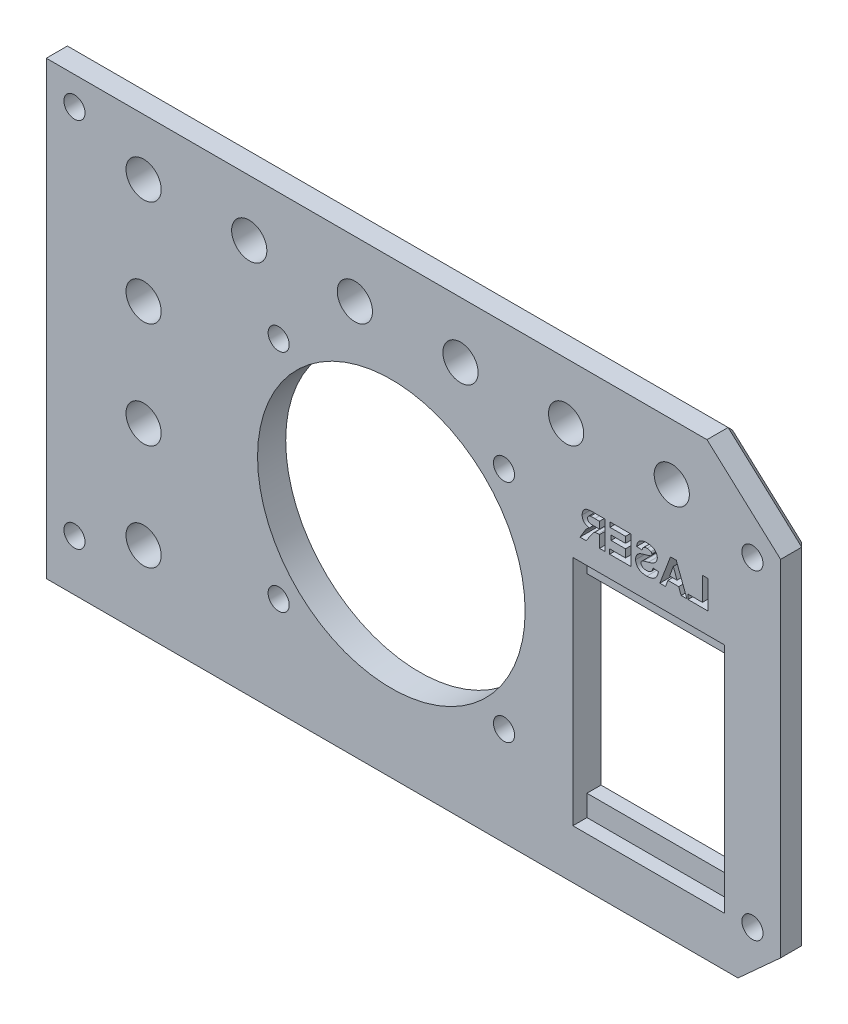
from build123d import *

# Parameters (mm, degrees)
EXTRUDE_1_DEPTH     = 4
SKETCH_3_W          = 21.5
SKETCH_3_H          = 27
CUT_EXTRUDE_1_DEPTH = 62.305061766
CUT_EXTRUDE_2_DEPTH = 10
CUT_EXTRUDE_3_DEPTH = 10
SKETCH_5_R          = 1.5
CUT_EXTRUDE_4_DEPTH = 10
CUT_EXTRUDE_5_DEPTH = 2
SKETCH_7_R          = 1.5
CUT_EXTRUDE_6_DEPTH = 4
SKETCH_8_R          = 2.5
CUT_EXTRUDE_7_DEPTH = 5
SKETCH_9_R          = 2.5
CUT_EXTRUDE_8_DEPTH = 5
CHAMFER_1_SIZE      = 1


with BuildPart() as part:
    # Эскиз1 → Бобышка-Вытянуть1 (new body)
    with BuildSketch(Plane.XY):
        Polygon((41.682625066, 32), (52.137420325, 22.505793147), (52.137420325, -26.505793147), (46.087330134, -32), (-52.137420325, -32), (-52.137420325, 32), align=None)
    extrude(amount=EXTRUDE_1_DEPTH)

    # Эскиз3 → Вырез-Вытянуть1 (cut, through all)
    with BuildSketch(Plane(origin=(0, 0, 0), x_dir=(-1, 0, 0), z_dir=(0, 0, -1))):
        with Locations((-33.387420325, -8.5)):
            Rectangle(SKETCH_3_W, SKETCH_3_H)
    extrude(amount=-CUT_EXTRUDE_1_DEPTH, mode=Mode.SUBTRACT)

    # Эскиз2 → Вырез-Вытянуть2 (cut)
    with BuildSketch(Plane(origin=(0, 0, 0), x_dir=(-1, 0, 0), z_dir=(0, 0, -1))):
        with BuildLine():
            ThreePointArc((3.137420325, 17), (-10.297608518, -15.435028843), (22.137420325, -2))
            ThreePointArc((22.137420325, -2), (16.572449168, 11.435028843), (3.137420325, 17))
        make_face()
    extrude(amount=-CUT_EXTRUDE_2_DEPTH, mode=Mode.SUBTRACT)

    # Эскиз4 → Вырез-Вытянуть3 (cut)
    # profile 1 of 5: a face of its own
    with BuildSketch(Plane(origin=(0, 0, 0), x_dir=(-1, 0, 0), z_dir=(0, 0, -1))):
        Polygon((-41.804576949, 11), (-41.804576949, 15), (-41.03534618, 15), (-41.03534618, 11.666666667), (-38.984064128, 11.666666667), (-38.984064128, 11), align=None)
    # profile 2 of 5: a face of its own
    with BuildSketch(Plane(origin=(0, 0, 0), x_dir=(-1, 0, 0), z_dir=(0, 0, -1))):
        Polygon((-34.984064128, 11), (-35.799769257, 11), (-36.137109, 11.923076923), (-37.67236541, 11.923076923), (-38.009705154, 11), (-38.830217975, 11), (-37.318198744, 15), (-36.503294898, 15), align=None)
        Polygon((-36.381500026, 12.58974359), (-36.907141051, 14.025641026), (-37.431179513, 12.58974359), align=None, mode=Mode.SUBTRACT)
    # profile 3 of 5: a face of its own
    with BuildSketch(Plane(origin=(0, 0, 0), x_dir=(-1, 0, 0), z_dir=(0, 0, -1))):
        with BuildLine():
            Line((-34.778935923, 12.333333333), (-34.009705154, 12.384615385))
            add(Edge.make_bspline(
                [(-34.009705154, 12.384615385), (-34.00357691, 12.352433478), (-33.991673186, 12.289922172), (-33.965225348, 12.200835025), (-33.936113597, 12.117780539), (-33.901323459, 12.041649332), (-33.863237144, 11.971034163), (-33.818725848, 11.907946687), (-33.770894791, 11.850372682), (-33.717376243, 11.80037996), (-33.65906848, 11.756595643), (-33.595680552, 11.719254919), (-33.527899321, 11.686935848), (-33.455559054, 11.660322118), (-33.377914175, 11.640454838), (-33.295641083, 11.626320447), (-33.208621785, 11.617269173), (-33.149151024, 11.616023084), (-33.118679513, 11.615384615)],
                knots=[0, 0, 0, 0, 1.204560339, 2.339781841, 3.415289417, 4.440034832, 5.416475564, 6.362424008, 7.275913008, 8.16578645, 9.05021719, 9.95355393, 10.867835453, 11.809845306, 12.784702352, 13.812224031, 14.87903166, 16, 16, 16, 16], degree=3))
            add(Edge.make_bspline(
                [(-33.118679513, 11.615384615), (-33.08660632, 11.615734532), (-33.024222307, 11.616415138), (-32.933820976, 11.624858649), (-32.849291624, 11.636954887), (-32.771380677, 11.656102948), (-32.698633221, 11.677517025), (-32.632856002, 11.706813764), (-32.572984586, 11.740603317), (-32.519173216, 11.778945704), (-32.472211984, 11.821470163), (-32.431127954, 11.865864318), (-32.395346478, 11.911169054), (-32.367183924, 11.959394794), (-32.344392347, 12.008591091), (-32.32932871, 12.060225556), (-32.319152332, 12.113112549), (-32.317985398, 12.149257204), (-32.317397462, 12.167467949)],
                knots=[0, 0, 0, 0, 1.417779877, 2.757654889, 4.012140507, 5.189587551, 6.302846416, 7.360586765, 8.365575446, 9.33904572, 10.275781718, 11.161696098, 12.012180333, 12.822428111, 13.625933072, 14.403138519, 15.195454004, 16, 16, 16, 16], degree=3))
            add(Edge.make_bspline(
                [(-32.317397462, 12.167467949), (-32.318118515, 12.190284535), (-32.31952915, 12.234921847), (-32.336511788, 12.298735775), (-32.361979986, 12.357857535), (-32.400326293, 12.411413899), (-32.451873168, 12.46035661), (-32.517626343, 12.506141318), (-32.599421217, 12.547329649), (-32.660102373, 12.570304576), (-32.692397462, 12.582532051)],
                knots=[0, 0, 0, 0, 0.90494901, 1.770400303, 2.607161909, 3.452839393, 4.36912122, 5.420987164, 6.627424851, 8, 8, 8, 8], degree=3))
            add(Edge.make_bspline(
                [(-32.692397462, 12.582532051), (-32.706254429, 12.587175585), (-32.737264071, 12.597567059), (-32.790163229, 12.612425887), (-32.853881669, 12.630980616), (-32.929340164, 12.652071027), (-33.016513342, 12.673640966), (-33.114427591, 12.700212683), (-33.224276595, 12.726653713), (-33.30112709, 12.746172475), (-33.341435923, 12.756410256)],
                knots=[0, 0, 0, 0, 0.521821638, 1.167752076, 1.961721917, 2.891982557, 3.96540661, 5.168436773, 6.514817513, 8, 8, 8, 8], degree=3))
            add(Edge.make_bspline(
                [(-33.341435923, 12.756410256), (-33.393929987, 12.769516799), (-33.4952087, 12.79480373), (-33.639655336, 12.839787389), (-33.77269333, 12.884481144), (-33.893041741, 12.932976266), (-34.002028061, 12.981986112), (-34.097889405, 13.034951496), (-34.182626189, 13.089121737), (-34.232004279, 13.129609899), (-34.255698744, 13.149038462)],
                knots=[0, 0, 0, 0, 1.293880989, 2.496331788, 3.617634808, 4.64976062, 5.598842568, 6.473791081, 7.267636666, 8, 8, 8, 8], degree=3))
            add(Edge.make_bspline(
                [(-34.255698744, 13.149038462), (-34.28508296, 13.176550777), (-34.342693432, 13.230491214), (-34.418528678, 13.319125706), (-34.482250934, 13.412753864), (-34.534701327, 13.51068459), (-34.575087137, 13.613481666), (-34.60371208, 13.72045701), (-34.622239184, 13.831889817), (-34.624129747, 13.907778199), (-34.625089769, 13.946314103)],
                knots=[0, 0, 0, 0, 1.064429417, 2.086912298, 3.078678339, 4.055528992, 5.020032834, 5.993708893, 6.981211098, 8, 8, 8, 8], degree=3))
            add(Edge.make_bspline(
                [(-34.625089769, 13.946314103), (-34.623220118, 13.996179102), (-34.619511287, 14.095096377), (-34.585498891, 14.240491268), (-34.532516871, 14.38078614), (-34.471070291, 14.492185464), (-34.412033385, 14.576459473), (-34.363007533, 14.636933731), (-34.309147897, 14.693531823), (-34.249716716, 14.744873142), (-34.186920816, 14.793965044), (-34.118327243, 14.83755924), (-34.045880831, 14.878622561), (-33.94104262, 14.927301218), (-33.798701096, 14.97802916), (-33.613507127, 15.020789596), (-33.411867566, 15.046494141), (-33.272070238, 15.049647545), (-33.199609, 15.051282051)],
                knots=[0, 0, 0, 0, 1.180131776, 2.341029169, 3.518901375, 4.725685298, 5.343762192, 5.955650671, 6.568945152, 7.192346361, 7.815201106, 8.455999361, 9.116257477, 9.787318263, 11.192748436, 12.688084276, 14.283332633, 16, 16, 16, 16], degree=3))
            add(Edge.make_bspline(
                [(-33.199609, 15.051282051), (-33.140277678, 15.050488643), (-33.024879524, 15.04894548), (-32.857596495, 15.033340774), (-32.70134507, 15.009053893), (-32.556673553, 14.97419019), (-32.423514538, 14.928126087), (-32.301351861, 14.873255031), (-32.19028933, 14.808109319), (-32.091679023, 14.732315102), (-32.003826692, 14.648756839), (-31.927189582, 14.557486966), (-31.861474696, 14.459658163), (-31.806257918, 14.355341924), (-31.762896327, 14.244001911), (-31.731048951, 14.125777055), (-31.70998482, 14.000945627), (-31.704705031, 13.915409885), (-31.702012846, 13.871794872)],
                knots=[0, 0, 0, 0, 1.325124071, 2.577337985, 3.749592149, 4.855247722, 5.896868755, 6.892903601, 7.842551483, 8.766257401, 9.665194363, 10.546067736, 11.423174165, 12.293291263, 13.177512979, 14.086532529, 15.024315359, 16, 16, 16, 16], degree=3))
            Line((-31.702012846, 13.871794872), (-32.471243616, 13.820512821))
            add(Edge.make_bspline(
                [(-32.471243616, 13.820512821), (-32.475681114, 13.844633834), (-32.484329336, 13.891643182), (-32.503132939, 13.958970118), (-32.524342491, 14.021239855), (-32.549167173, 14.078451993), (-32.57915239, 14.129581808), (-32.611784922, 14.176237871), (-32.647964954, 14.217798517), (-32.688890419, 14.253125682), (-32.733154944, 14.285271953), (-32.783600902, 14.311037934), (-32.838114552, 14.334943093), (-32.898769808, 14.35291391), (-32.964401869, 14.367169008), (-33.035048965, 14.377736811), (-33.110857537, 14.382896607), (-33.16301104, 14.384029343), (-33.189993616, 14.384615385)],
                knots=[0, 0, 0, 0, 1.151066407, 2.24330871, 3.278475654, 4.238599069, 5.165719782, 6.056502506, 6.909492653, 7.744782051, 8.590364415, 9.471203867, 10.39832458, 11.382154319, 12.435022857, 13.550631277, 14.73277401, 16, 16, 16, 16], degree=3))
            add(Edge.make_bspline(
                [(-33.189993616, 14.384615385), (-33.218048125, 14.384098006), (-33.272629426, 14.383091423), (-33.35216893, 14.376914172), (-33.426782952, 14.365511561), (-33.496837943, 14.35066819), (-33.562240326, 14.33047481), (-33.622852082, 14.305852292), (-33.678950515, 14.276864008), (-33.713156894, 14.254057026), (-33.730057718, 14.242788462)],
                knots=[0, 0, 0, 0, 1.186678824, 2.308736671, 3.37120409, 4.377216403, 5.334874112, 6.262130804, 7.141346615, 8, 8, 8, 8], degree=3))
            add(Edge.make_bspline(
                [(-33.730057718, 14.242788462), (-33.749399293, 14.227395282), (-33.786857919, 14.197583471), (-33.827171328, 14.13838735), (-33.851440093, 14.071527107), (-33.854361115, 14.024245686), (-33.855859, 14)],
                knots=[0, 0, 0, 0, 1.037857257, 2.010007357, 2.979541333, 4, 4, 4, 4], degree=3))
            add(Edge.make_bspline(
                [(-33.855859, 14), (-33.854634003, 13.977340797), (-33.852220953, 13.932705773), (-33.827882237, 13.869300756), (-33.790452609, 13.810551447), (-33.75548076, 13.778638052), (-33.737269257, 13.762019231)],
                knots=[0, 0, 0, 0, 0.98538058, 1.941042925, 2.927803204, 4, 4, 4, 4], degree=3))
            add(Edge.make_bspline(
                [(-33.737269257, 13.762019231), (-33.722816082, 13.751232782), (-33.690519252, 13.727129559), (-33.631357863, 13.696492082), (-33.559948513, 13.663309843), (-33.474663242, 13.630870542), (-33.376068854, 13.598491456), (-33.264159354, 13.564683947), (-33.138865911, 13.530422541), (-33.003382195, 13.497242047), (-32.865828065, 13.464627528), (-32.734563948, 13.428970653), (-32.612507196, 13.394207957), (-32.500223751, 13.357771011), (-32.397134813, 13.322299757), (-32.303741151, 13.285868225), (-32.219401488, 13.250387989), (-32.121052091, 13.201600151), (-32.009582941, 13.135515053), (-31.892750698, 13.039449342), (-31.789427487, 12.931465208), (-31.717434619, 12.829643618), (-31.667979286, 12.742074342), (-31.63613527, 12.672271432), (-31.608587698, 12.598716766), (-31.58616405, 12.52132906), (-31.5699123, 12.439999421), (-31.556463032, 12.355349208), (-31.549591551, 12.266675381), (-31.548646757, 12.206206141), (-31.548166692, 12.175480769)],
                knots=[0, 0, 0, 0, 0.511875881, 1.143829537, 1.88775736, 2.750598373, 3.734912702, 4.837306479, 6.073130119, 7.42648979, 8.801963576, 10.091065733, 11.292408984, 12.408830014, 13.446061236, 14.39066453, 15.257936293, 16.045629259, 17.510392066, 18.929669597, 20.331293837, 21.746891395, 22.460690638, 23.187651344, 23.925159671, 24.69163991, 25.474819891, 26.281170188, 27.126635539, 28, 28, 28, 28], degree=3))
            add(Edge.make_bspline(
                [(-31.548166692, 12.175480769), (-31.548826797, 12.147145107), (-31.5501377, 12.090873227), (-31.559298647, 12.007351551), (-31.573465821, 11.925313066), (-31.594438107, 11.844654925), (-31.622259984, 11.765535802), (-31.653585206, 11.686813788), (-31.692755633, 11.610205645), (-31.737336922, 11.535647922), (-31.786512109, 11.46319657), (-31.842236729, 11.396361848), (-31.901237737, 11.332913989), (-31.967285139, 11.276405719), (-32.036300361, 11.222261532), (-32.111440087, 11.174310529), (-32.190943903, 11.130919117), (-32.275314497, 11.092411257), (-32.364851011, 11.058855137), (-32.459437154, 11.028987857), (-32.559925091, 11.004543783), (-32.665476897, 10.983592132), (-32.776478842, 10.967658943), (-32.892792151, 10.956533872), (-33.014443266, 10.950260003), (-33.097305001, 10.949238353), (-33.139512846, 10.948717949)],
                knots=[0, 0, 0, 0, 0.900570041, 1.788444861, 2.667795364, 3.545012114, 4.433698372, 5.332345486, 6.235991676, 7.164928091, 8.092777575, 9.015680987, 9.928493428, 10.842962589, 11.775229507, 12.714851019, 13.672254427, 14.652424454, 15.660007982, 16.709910502, 17.803296389, 18.945495772, 20.129342395, 21.366102753, 22.658353839, 24, 24, 24, 24], degree=3))
            add(Edge.make_bspline(
                [(-33.139512846, 10.948717949), (-33.200454463, 10.949712924), (-33.319109236, 10.951650165), (-33.49149331, 10.968989996), (-33.653178161, 10.995529857), (-33.803900575, 11.034048148), (-33.943844775, 11.08349694), (-34.072946931, 11.144406933), (-34.190582592, 11.217142032), (-34.298208739, 11.299938288), (-34.394391421, 11.394304458), (-34.480879083, 11.49828531), (-34.556504982, 11.612817175), (-34.621219408, 11.737720909), (-34.676658455, 11.872321285), (-34.72237957, 12.016680108), (-34.756805167, 12.171485894), (-34.771431421, 12.278451137), (-34.778935923, 12.333333333)],
                knots=[0, 0, 0, 0, 1.217954099, 2.371385517, 3.459848295, 4.490682126, 5.476952527, 6.422732854, 7.338496285, 8.236688651, 9.131557988, 10.026443255, 10.935708282, 11.869506048, 12.834296687, 13.842423496, 14.892981177, 16, 16, 16, 16], degree=3))
        make_face()
    # profile 4 of 5: a face of its own
    with BuildSketch(Plane(origin=(0, 0, 0), x_dir=(-1, 0, 0), z_dir=(0, 0, -1))):
        Polygon((-30.881500026, 11), (-30.881500026, 15), (-27.907141051, 15), (-27.907141051, 14.333333333), (-30.112269257, 14.333333333), (-30.112269257, 13.461538462), (-28.060987205, 13.461538462), (-28.060987205, 12.794871795), (-30.112269257, 12.794871795), (-30.112269257, 11.666666667), (-27.855859, 11.666666667), (-27.855859, 11), align=None)
    # profile 5 of 5: a face of its own
    with BuildSketch(Plane(origin=(0, 0, 0), x_dir=(-1, 0, 0), z_dir=(0, 0, -1))):
        with BuildLine():
            Line((-27.189192333, 11), (-27.189192333, 15))
            Line((-27.189192333, 15), (-25.510506436, 15))
            add(Edge.make_bspline(
                [(-25.510506436, 15), (-25.459489512, 14.999685584), (-25.361170563, 14.999079646), (-25.218982182, 14.994661029), (-25.087852577, 14.98540377), (-24.967200056, 14.974919847), (-24.857604123, 14.959666415), (-24.758631454, 14.941392954), (-24.670448678, 14.920216531), (-24.591769155, 14.894854332), (-24.520029414, 14.865826413), (-24.453200324, 14.831275023), (-24.390547082, 14.790793823), (-24.331107395, 14.745778088), (-24.274629559, 14.696158651), (-24.222661897, 14.640622336), (-24.174298994, 14.579996096), (-24.129579873, 14.514784345), (-24.090185127, 14.445275033), (-24.054188672, 14.373700467), (-24.0248862, 14.299298985), (-24.000682624, 14.222421075), (-23.981348435, 14.143233648), (-23.967928873, 14.061535382), (-23.959551186, 13.977474151), (-23.958803309, 13.920693228), (-23.958423103, 13.891826923)],
                knots=[0, 0, 0, 0, 1.675828044, 3.229627355, 4.67171229, 5.993455049, 7.206927059, 8.304770529, 9.29850117, 10.183580433, 11.017754134, 11.837875825, 12.650738409, 13.464925643, 14.285328857, 15.117007378, 15.959673368, 16.830859064, 17.711229498, 18.58228265, 19.460420693, 20.334473227, 21.228207035, 22.135446768, 23.052097822, 24, 24, 24, 24], degree=3))
            add(Edge.make_bspline(
                [(-23.958423103, 13.891826923), (-23.959128328, 13.855463459), (-23.960506532, 13.784399226), (-23.973189499, 13.680241178), (-23.992026944, 13.580725598), (-24.018879576, 13.485714616), (-24.055801399, 13.396325697), (-24.098663122, 13.311306629), (-24.149782927, 13.2309458), (-24.208813511, 13.156039863), (-24.275702026, 13.086522511), (-24.350741603, 13.023824359), (-24.433396484, 12.967700367), (-24.52416668, 12.91847418), (-24.622420154, 12.876391124), (-24.728582964, 12.840983723), (-24.842174511, 12.812166044), (-24.921188728, 12.798606464), (-24.961628231, 12.791666667)],
                knots=[0, 0, 0, 0, 1.05911256, 2.069797862, 3.05271628, 4.008392045, 4.940519534, 5.866323021, 6.779546087, 7.71056835, 8.640711998, 9.585328432, 10.554502533, 11.547017206, 12.589327225, 13.664782803, 14.804835066, 16, 16, 16, 16], degree=3))
            add(Edge.make_bspline(
                [(-24.961628231, 12.791666667), (-24.92251869, 12.76576405), (-24.845975991, 12.7150691), (-24.740073657, 12.631573883), (-24.644998488, 12.543939195), (-24.573012366, 12.466008978), (-24.51769845, 12.397477725), (-24.473161297, 12.337539629), (-24.425120838, 12.268559576), (-24.374048245, 12.19050019), (-24.318433682, 12.10405211), (-24.260345555, 12.007892117), (-24.198568287, 11.90295817), (-24.157032867, 11.829656495), (-24.135506436, 11.791666667)],
                knots=[0, 0, 0, 0, 1.285445069, 2.515791127, 3.691898215, 4.826622834, 5.420063933, 6.105349801, 6.873086501, 7.723915395, 8.66222816, 9.690593598, 10.803111229, 12, 12, 12, 12], degree=3))
            Line((-24.135506436, 11.791666667), (-23.650730795, 11))
            Line((-23.650730795, 11), (-24.549769257, 11))
            Line((-24.549769257, 11), (-25.118679513, 11.907852564))
            add(Edge.make_bspline(
                [(-25.118679513, 11.907852564), (-25.144807264, 11.944211404), (-25.194690511, 12.013627904), (-25.26670006, 12.112271004), (-25.332582407, 12.200081081), (-25.390584202, 12.278330011), (-25.443640312, 12.344799254), (-25.490139742, 12.400647139), (-25.529135358, 12.447072081), (-25.573258995, 12.493104413), (-25.624592162, 12.54041283), (-25.688138523, 12.586281032), (-25.753394739, 12.622846679), (-25.823311563, 12.650747127), (-25.904168257, 12.670201173), (-26.001370808, 12.682595873), (-26.117975491, 12.691740544), (-26.202257316, 12.692109059), (-26.247685923, 12.692307692)],
                knots=[0, 0, 0, 0, 1.465447777, 2.797841088, 3.997266218, 5.05856206, 5.985598736, 6.780315439, 7.437430484, 7.969193402, 8.866571936, 9.718200644, 10.52825214, 11.309096006, 12.174169268, 13.242355782, 14.513606761, 16, 16, 16, 16], degree=3))
            Line((-26.247685923, 12.692307692), (-26.419961564, 12.692307692))
            Line((-26.419961564, 12.692307692), (-26.419961564, 11))
            Line((-26.419961564, 11), (-27.189192333, 11))
        make_face()
        with BuildLine():
            Line((-26.419961564, 13.358974359), (-25.800570539, 13.358974359))
            add(Edge.make_bspline(
                [(-25.800570539, 13.358974359), (-25.752758401, 13.359076823), (-25.6616682, 13.359272035), (-25.532136122, 13.3620996), (-25.41642036, 13.364499518), (-25.315213385, 13.370529414), (-25.22806239, 13.376505609), (-25.155316981, 13.384272494), (-25.096364257, 13.393452701), (-25.037480396, 13.407725514), (-24.977163314, 13.432593072), (-24.912876717, 13.468011795), (-24.857932553, 13.513959484), (-24.810338218, 13.567079658), (-24.774030407, 13.629527255), (-24.745592803, 13.698520162), (-24.731174336, 13.775591464), (-24.728851948, 13.829011913), (-24.727653872, 13.856570513)],
                knots=[0, 0, 0, 0, 1.697953026, 3.23488743, 4.60134403, 5.807846676, 6.835100678, 7.703488618, 8.405232423, 8.952775585, 9.851109663, 10.713519226, 11.549115941, 12.382556273, 13.233359028, 14.101746968, 15.020727134, 16, 16, 16, 16], degree=3))
            add(Edge.make_bspline(
                [(-24.727653872, 13.856570513), (-24.729016458, 13.887400505), (-24.731645349, 13.946882003), (-24.752377156, 14.031524741), (-24.78856368, 14.106294947), (-24.838261512, 14.171316068), (-24.900649311, 14.22622084), (-24.974960079, 14.269803278), (-25.060641739, 14.30226167), (-25.122440885, 14.314248491), (-25.154737205, 14.320512821)],
                knots=[0, 0, 0, 0, 1.062977961, 2.050844577, 2.982300261, 3.90936959, 4.856017476, 5.831122378, 6.86654153, 8, 8, 8, 8], degree=3))
            add(Edge.make_bspline(
                [(-25.154737205, 14.320512821), (-25.165412787, 14.321685838), (-25.190716156, 14.324466134), (-25.235398906, 14.326251796), (-25.292531534, 14.328996554), (-25.362805575, 14.330118275), (-25.445593203, 14.332084553), (-25.541223618, 14.332445612), (-25.649392997, 14.333599168), (-25.725783751, 14.333425188), (-25.76611541, 14.333333333)],
                knots=[0, 0, 0, 0, 0.42127143, 0.998501726, 1.753681744, 2.66564073, 3.755712164, 5.002818897, 6.417592707, 8, 8, 8, 8], degree=3))
            Line((-25.76611541, 14.333333333), (-26.419961564, 14.333333333))
            Line((-26.419961564, 14.333333333), (-26.419961564, 13.358974359))
        make_face(mode=Mode.SUBTRACT)
    extrude(amount=-CUT_EXTRUDE_3_DEPTH, mode=Mode.SUBTRACT)


with BuildPart() as cut_extrude_3_piece_1:
    # of the separate pieces the step leaves, piece 1, a body of its own (cut_extrude_3_pieces)
    add(part.part.solids().sort_by_distance((41.682625066, 32, 0))[0])

    # Эскиз5 → Вырез-Вытянуть4 (cut)
    with BuildSketch(Plane(origin=(0, 0, 0), x_dir=(-1, 0, 0), z_dir=(0, 0, -1))):
        with Locations((-12.862579675, 14)):
            Circle(SKETCH_5_R)
        with Locations((-12.862579675, -18)):
            Circle(SKETCH_5_R)
        with Locations((19.137420325, 14)):
            Circle(SKETCH_5_R)
        with Locations((19.137420325, -18)):
            Circle(SKETCH_5_R)
    extrude(amount=-CUT_EXTRUDE_4_DEPTH, mode=Mode.SUBTRACT)

    # Эскиз6 → Вырез-Вытянуть5 (cut)
    with BuildSketch(Plane.XY.offset(4)):
        Polygon((22.637420325, -8.5), (22.637420325, -25), (44.137420325, -25), (44.137420325, 8), (22.637420325, 8), align=None)
    extrude(amount=-CUT_EXTRUDE_5_DEPTH, mode=Mode.SUBTRACT)

    # Эскиз7 → Вырез-Вытянуть6 (cut)
    with BuildSketch(Plane(origin=(0, 0, 0), x_dir=(-1, 0, 0), z_dir=(0, 0, -1))):
        with Locations((-48.137420325, -24.735793147)):
            Circle(SKETCH_7_R)
        with Locations((-48.137420325, 20.734206853)):
            Circle(SKETCH_7_R)
        with Locations((48.132579675, 28.004206853)):
            Circle(SKETCH_7_R)
        with Locations((48.132579675, -24.735793147)):
            Circle(SKETCH_7_R)
    extrude(amount=-CUT_EXTRUDE_6_DEPTH, mode=Mode.SUBTRACT)

    # Эскиз8 → Вырез-Вытянуть7 (cut)
    with BuildSketch(Plane(origin=(0, 0, 0), x_dir=(-1, 0, 0), z_dir=(0, 0, -1))):
        with Locations((-36.682625066, 24)):
            Circle(SKETCH_8_R)
        with Locations((-21.682625066, 24)):
            Circle(SKETCH_8_R)
        with Locations((-6.682625066, 24)):
            Circle(SKETCH_8_R)
        with Locations((8.317374934, 24)):
            Circle(SKETCH_8_R)
        with Locations((23.317374934, 24)):
            Circle(SKETCH_8_R)
        with Locations((38.317374934, 24)):
            Circle(SKETCH_8_R)
    extrude(amount=-CUT_EXTRUDE_7_DEPTH, mode=Mode.SUBTRACT)

    # Эскиз9 → Вырез-Вытянуть8 (cut)
    with BuildSketch(Plane(origin=(0, 0, 0), x_dir=(-1, 0, 0), z_dir=(0, 0, -1))):
        with Locations((38.317374934, 24)):
            Circle(SKETCH_9_R)
        with Locations((38.317374934, 9)):
            Circle(SKETCH_9_R)
        with Locations((38.317374934, -6)):
            Circle(SKETCH_9_R)
        with Locations((38.317374934, -21)):
            Circle(SKETCH_9_R)
    extrude(amount=-CUT_EXTRUDE_8_DEPTH, mode=Mode.SUBTRACT)

    # Фаска1
    chamfer_1_edges = [cut_extrude_3_piece_1.edges().sort_by_distance(p)[0] for p in [
        (-5.227397629, 32, 0),
        (46.910022696, 27.252896574, 0),
        (52.137420325, -2, 0),
        (49.112375229, -29.252896574, 0),
        (-52.137420325, 0, 0),
        (-3.025045096, -32, 0),
    ]]
    chamfer(chamfer_1_edges, length=CHAMFER_1_SIZE)


with BuildPart() as cut_extrude_3_piece_2:
    # of the separate pieces the step leaves, piece 2, a body of its own (cut_extrude_3_pieces)
    add(part.part.solids().sort_by_distance((26.419961564, 14.333333333, 0))[0])


with BuildPart() as cut_extrude_3_piece_3:
    # of the separate pieces the step leaves, piece 3, a body of its own (cut_extrude_3_pieces)
    add(part.part.solids().sort_by_distance((37.431179513, 12.58974359, 0))[0])


solid = Compound([cut_extrude_3_piece_1.part, cut_extrude_3_piece_2.part, cut_extrude_3_piece_3.part])
